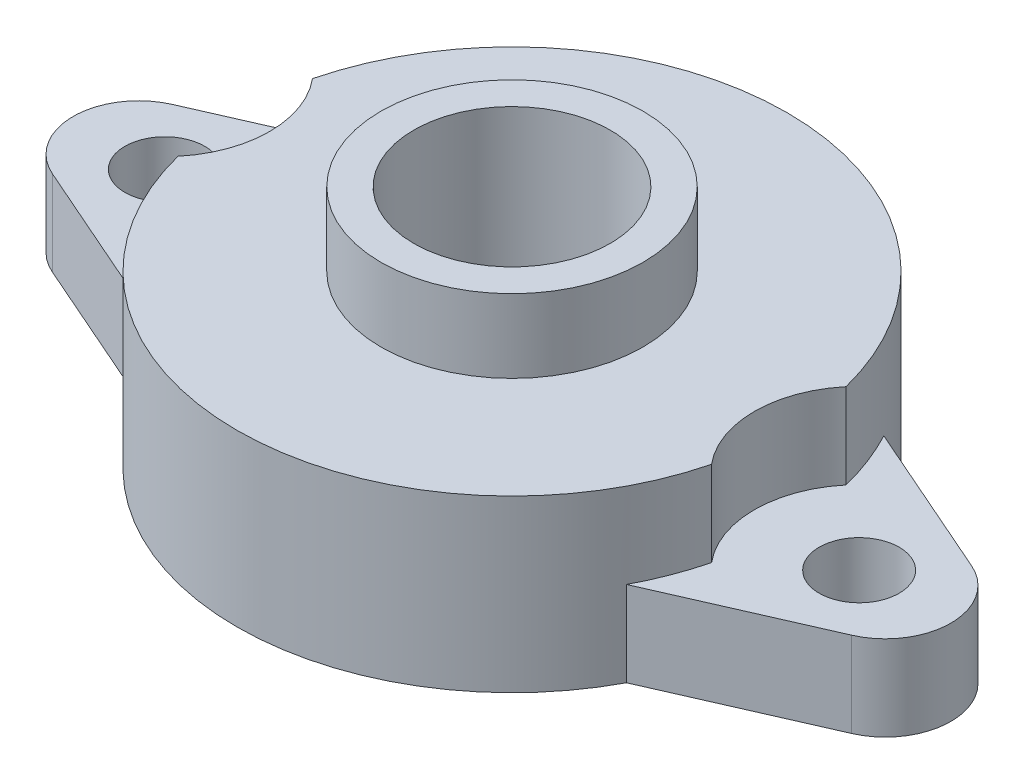
from build123d import *

# Parameters (mm, degrees)
SKETCH3_R           = 3.05
BOSS_EXTRUDE1_DEPTH = 6.5
BOSS_EXTRUDE2_DEPTH = 6.5
SKETCH5_R           = 10
BOSS_EXTRUDE3_DEPTH = 5.6
SKETCH6_R           = 7.5
CUT_EXTRUDE1_DEPTH  = 44.694507664


with BuildPart() as part:
    # Sketch3 → Boss-Extrude1 (new body)
    # profile 1 of 5: a face of its own
    with BuildSketch(Plane(origin=(0, 0, 0), x_dir=(1, 0, 0), z_dir=(0, 1, 0))):
        with BuildLine():
            Line((0, -17.966933692), (-18.56176162, -9.821456387))
            ThreePointArc((-18.56176162, -9.821456387), (0, -21), (18.56176162, -9.821456387))
            Line((18.56176162, -9.821456387), (0, -17.966933692))
        make_face()
    # profile 2 of 5: a face of its own
    with BuildSketch(Plane(origin=(0, 0, 0), x_dir=(1, 0, 0), z_dir=(0, 1, 0))):
        with BuildLine():
            Line((0, 17.966933692), (-18.56176162, 9.821456387))
            ThreePointArc((-18.56176162, 9.821456387), (-21, 0), (-18.56176162, -9.821456387))
            Line((-18.56176162, -9.821456387), (0, -17.966933692))
            Line((0, -17.966933692), (18.56176162, -9.821456387))
            ThreePointArc((18.56176162, -9.821456387), (20.381327165, -5.059792782), (21, 0))
            ThreePointArc((21, 0), (20.381327165, 5.059792782), (18.56176162, 9.821456387))
            Line((18.56176162, 9.821456387), (0, 17.966933692))
        make_face()
    # profile 3 of 5: a face of its own
    with BuildSketch(Plane(origin=(0, 0, 0), x_dir=(1, 0, 0), z_dir=(0, 1, 0))):
        with BuildLine():
            ThreePointArc((18.56176162, 9.821456387), (0, 21), (-18.56176162, 9.821456387))
            Line((-18.56176162, 9.821456387), (0, 17.966933692))
            Line((0, 17.966933692), (18.56176162, 9.821456387))
        make_face()
    # profile 4 of 5: a face of its own
    with BuildSketch(Plane(origin=(0, 0, 0), x_dir=(1, 0, 0), z_dir=(0, 1, 0))):
        with BuildLine():
            Line((30.509208106, 4.578545925), (18.56176162, 9.821456387))
            ThreePointArc((18.56176162, 9.821456387), (20.381327165, 5.059792782), (21, 0))
            ThreePointArc((21, 0), (20.381327165, -5.059792782), (18.56176162, -9.821456387))
            Line((18.56176162, -9.821456387), (30.509208106, -4.578545925))
            ThreePointArc((30.509208106, -4.578545925), (33.5, 0), (30.509208106, 4.578545925))
        make_face()
        with Locations(Location((26.5, 0, 0), (0, 0, 90))):
            Circle(SKETCH3_R, mode=Mode.SUBTRACT)
    # profile 5 of 5: a face of its own
    with BuildSketch(Plane(origin=(0, 0, 0), x_dir=(1, 0, 0), z_dir=(0, 1, 0))):
        with BuildLine():
            Line((-18.56176162, 9.821456387), (-30.509208106, 4.578545925))
            ThreePointArc((-30.509208106, 4.578545925), (-33.5, 0), (-30.509208106, -4.578545925))
            Line((-30.509208106, -4.578545925), (-18.56176162, -9.821456387))
            ThreePointArc((-18.56176162, -9.821456387), (-21, 0), (-18.56176162, 9.821456387))
        make_face()
        with Locations(Location((-26.5, 0, 0), (0, 0, 90))):
            Circle(SKETCH3_R, mode=Mode.SUBTRACT)
    extrude(amount=BOSS_EXTRUDE1_DEPTH)

    # Sketch4 → Boss-Extrude2 (add)
    with BuildSketch(Plane(origin=(0, 6.5, 0), x_dir=(1, 0, 0), z_dir=(0, 1, 0))):
        with BuildLine():
            ThreePointArc((20.363207547, 5.132229378), (0, 21), (-20.363207547, 5.132229378))
            ThreePointArc((-20.363207547, 5.132229378), (-18.5, 0), (-20.363207547, -5.132229378))
            ThreePointArc((-20.363207547, -5.132229378), (0, -21), (20.363207547, -5.132229378))
            ThreePointArc((20.363207547, -5.132229378), (18.5, 0), (20.363207547, 5.132229378))
        make_face()
    extrude(amount=BOSS_EXTRUDE2_DEPTH)

    # Sketch5 → Boss-Extrude3 (add)
    with BuildSketch(Plane(origin=(0, 13, 0), x_dir=(1, 0, 0), z_dir=(0, 1, 0))):
        with Locations(Location((0, 0, 0), (0, 0, 270))):
            Circle(SKETCH5_R)
    extrude(amount=BOSS_EXTRUDE3_DEPTH)

    # Sketch6 → Cut-Extrude1 (cut, through all)
    with BuildSketch(Plane(origin=(0, 18.6, 0), x_dir=(1, 0, 0), z_dir=(0, 1, 0))):
        with Locations(Location((0, 0, 0), (0, 0, 270))):
            Circle(SKETCH6_R)
    extrude(amount=-CUT_EXTRUDE1_DEPTH, mode=Mode.SUBTRACT)


solid = part.part
